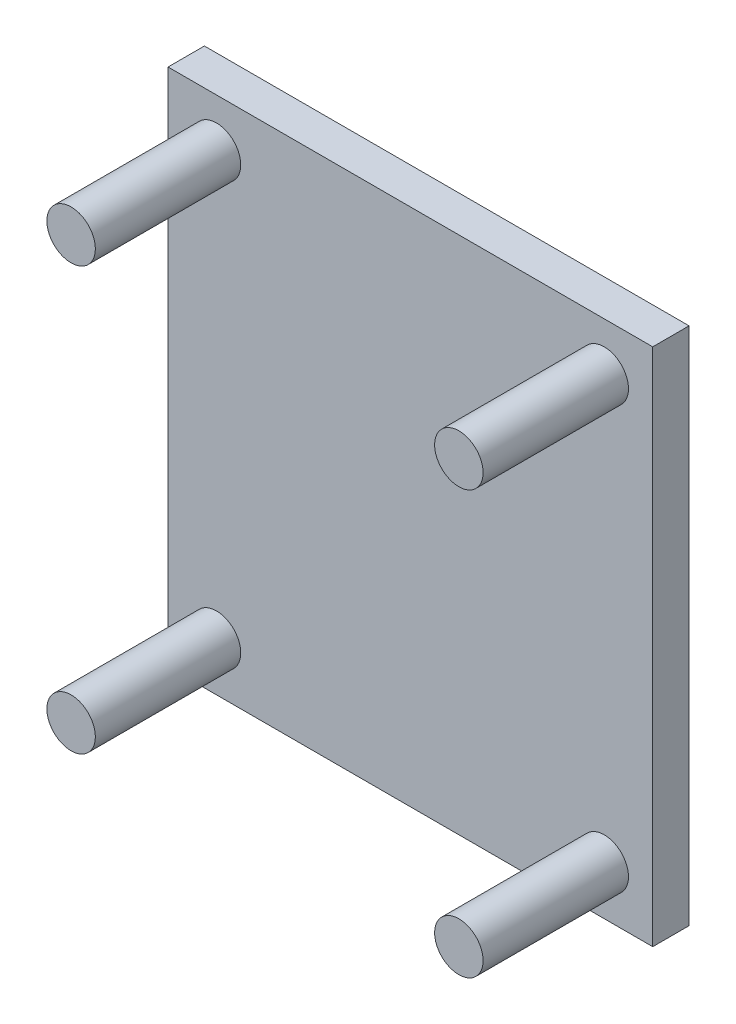
from build123d import *

# Parameters (mm, degrees)
SKETCH_1_W         = 40
SKETCH_1_H         = 42.876181986
FORMER_BASE_DEPTH  = 3
FORMER_POSTS_START = 3
SKETCH_2_R         = 2
FORMER_POSTS_DEPTH = 12


with BuildPart() as part:
    # Эскиз1 → Former_base (new body)
    with BuildSketch(Plane.XY):
        Rectangle(SKETCH_1_W, SKETCH_1_H)
    extrude(amount=FORMER_BASE_DEPTH)

    # Эскиз2 → Former_posts (add)
    with BuildSketch(Plane.XY.offset(FORMER_POSTS_START)):
        with Locations((-16, -17.438090993)):
            Circle(SKETCH_2_R)
        with Locations((-16, 17.438090993)):
            Circle(SKETCH_2_R)
        with Locations((16, -17.438090993)):
            Circle(SKETCH_2_R)
        with Locations((16, 17.438090993)):
            Circle(SKETCH_2_R)
    extrude(amount=FORMER_POSTS_DEPTH)


solid = part.part
